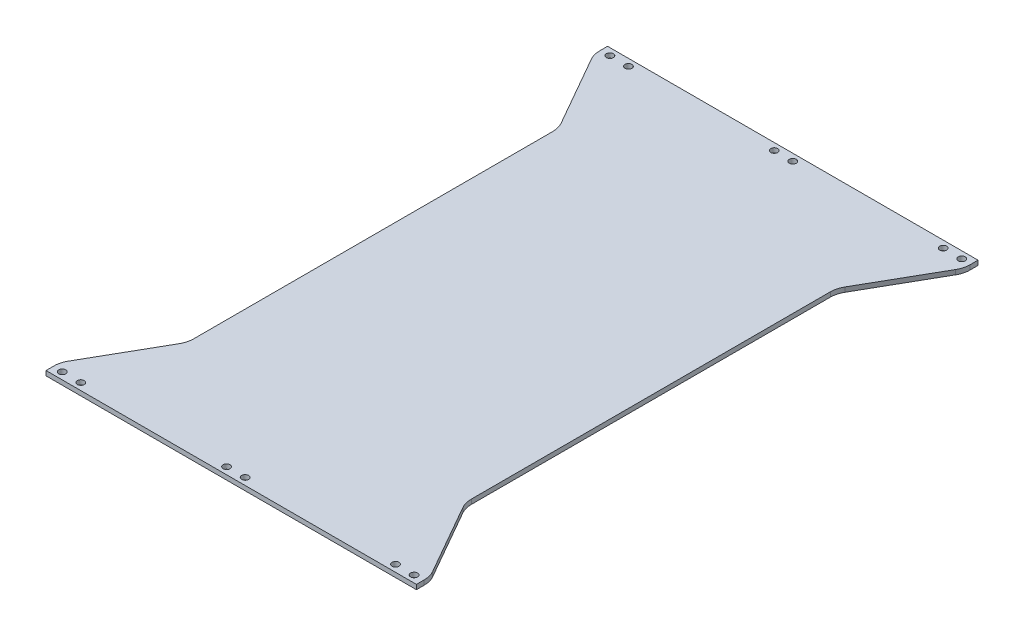
from build123d import *

# Parameters (mm, degrees)
SKETCH2_R           = 1.5
BOSS_EXTRUDE1_DEPTH = 2
FILLET1_R           = 10


with BuildPart() as part:
    # Sketch2 → Boss-Extrude1 (new body)
    with BuildSketch(Plane(origin=(0, 0, 0), x_dir=(1, 0, 0), z_dir=(0, 1, 0))):
        Polygon((688.047893911, -1476.918579287), (688.047893911, -1482.918579287), (708.047893911, -1517.918579287), (708.047893911, -1677.918579287), (688.047893911, -1712.918579287), (688.047893911, -1718.918579287), (847.682893911, -1718.918579287), (847.682893911, -1712.918579287), (827.682893911, -1677.918579287), (827.682893911, -1517.918579287), (847.682893911, -1482.918579287), (847.682893911, -1476.918579287), align=None)
        with Locations(Location((843.682893911, -1479.918579287, 0), (0, 0, 270))):
            Circle(SKETCH2_R, mode=Mode.SUBTRACT)
        with Locations(Location((835.682893911, -1479.918579287, 0), (0, 0, 270))):
            Circle(SKETCH2_R, mode=Mode.SUBTRACT)
        with Locations(Location((762.867893911, -1479.918579287, 0), (0, 0, 270))):
            Circle(SKETCH2_R, mode=Mode.SUBTRACT)
        with Locations(Location((770.867893911, -1479.918579287, 0), (0, 0, 270))):
            Circle(SKETCH2_R, mode=Mode.SUBTRACT)
        with Locations(Location((700.047893911, -1479.918579287, 0), (0, 0, 270))):
            Circle(SKETCH2_R, mode=Mode.SUBTRACT)
        with Locations(Location((692.047893911, -1479.918579287, 0), (0, 0, 270))):
            Circle(SKETCH2_R, mode=Mode.SUBTRACT)
        with Locations(Location((692.047893911, -1715.918579287, 0), (0, 0, 90))):
            Circle(SKETCH2_R, mode=Mode.SUBTRACT)
        with Locations(Location((700.047893911, -1715.918579287, 0), (0, 0, 90))):
            Circle(SKETCH2_R, mode=Mode.SUBTRACT)
        with Locations(Location((770.867893911, -1715.918579287, 0), (0, 0, 90))):
            Circle(SKETCH2_R, mode=Mode.SUBTRACT)
        with Locations(Location((762.867893911, -1715.918579287, 0), (0, 0, 90))):
            Circle(SKETCH2_R, mode=Mode.SUBTRACT)
        with Locations(Location((835.682893911, -1715.918579287, 0), (0, 0, 90))):
            Circle(SKETCH2_R, mode=Mode.SUBTRACT)
        with Locations(Location((843.682893911, -1715.918579287, 0), (0, 0, 90))):
            Circle(SKETCH2_R, mode=Mode.SUBTRACT)
    extrude(amount=BOSS_EXTRUDE1_DEPTH)

    # Fillet1
    fillet1_edges = [part.edges().sort_by_distance(p)[0] for p in [
        (847.682893911, 1, 1712.918579287),
        (688.047893911, 1, 1712.918579287),
        (708.047893911, 1, 1677.918579287),
        (708.047893911, 1, 1517.918579287),
        (688.047893911, 1, 1482.918579287),
        (847.682893911, 1, 1482.918579287),
        (827.682893911, 1, 1517.918579287),
        (827.682893911, 1, 1677.918579287),
    ]]
    fillet(fillet1_edges, radius=FILLET1_R)


solid = part.part
